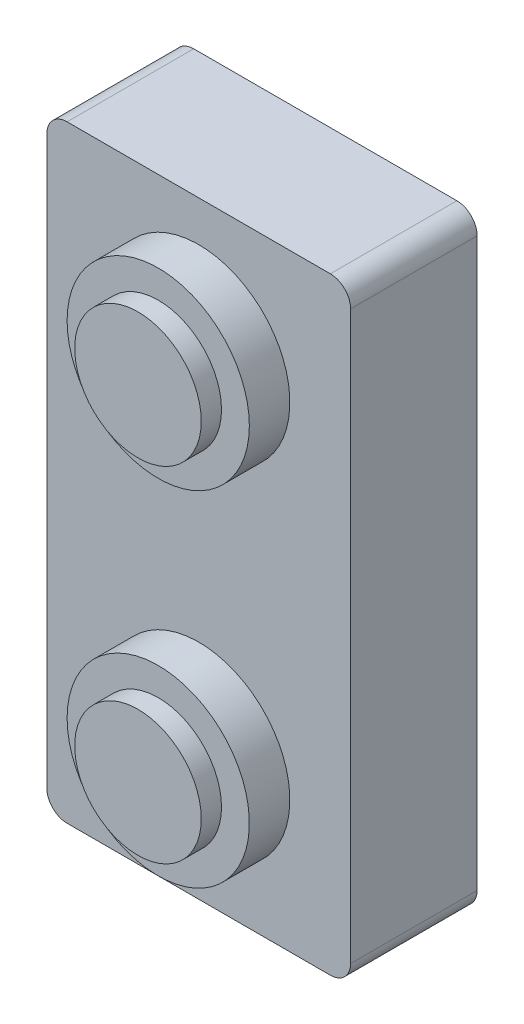
from build123d import *

# Parameters (mm, degrees)
SKETCH_1_W          = 30
SKETCH_1_H          = 60
EXTRUDE_1_DEPTH     = 12.5
SKETCH_2_R          = 9
EXTRUDE_2_DEPTH     = 4
SKETCH_3_R          = 6.25
EXTRUDE_3_DEPTH     = 2
FILLET_1_R          = 2
CUT_EXTRUDE_1_DEPTH = 10


with BuildPart() as part:
    # 草图1 → 凸台-拉伸1 (new body)
    with BuildSketch(Plane.XY):
        Rectangle(SKETCH_1_W, SKETCH_1_H)
    extrude(amount=EXTRUDE_1_DEPTH)

    # 草图2 → 凸台-拉伸2 (add)
    with BuildSketch(Plane.XY.offset(12.5)):
        with Locations(Location((0, 17, 0), (0, 0, 180))):
            Circle(SKETCH_2_R)
        with Locations(Location((0, -17, 0), (0, 0, 180))):
            Circle(SKETCH_2_R)
    extrude(amount=EXTRUDE_2_DEPTH)

    # 草图3 → 凸台-拉伸3 (add)
    with BuildSketch(Plane.XY.offset(16.5)):
        with Locations((0, 17)):
            Circle(SKETCH_3_R)
        with Locations((0, -17)):
            Circle(SKETCH_3_R)
    extrude(amount=EXTRUDE_3_DEPTH)

    # 圆角1
    fillet_1_edges = [part.edges().sort_by_distance(p)[0] for p in [
        (15, -30, 6.25),
        (-15, -30, 6.25),
        (-15, 30, 6.25),
        (15, 30, 6.25),
    ]]
    fillet(fillet_1_edges, radius=FILLET_1_R)

    # 草图4 → 切除-拉伸1 (cut)
    with BuildSketch(Plane.ZY.offset(15)):
        with BuildLine():
            ThreePointArc((10.25, 0), (8.751434736, 3.12134975), (5.37858787, 3.903926344))
            Line((5.37858787, 3.903926344), (6.25, 0))
            Line((6.25, 0), (10.25, 0))
        make_face()
        with BuildLine():
            Line((6.25, 0), (5.37858787, 3.903926344))
            ThreePointArc((5.37858787, 3.903926344), (3.12865025, 2.501434736), (2.25, 0))
            Line((2.25, 0), (6.25, 0))
        make_face()
        with BuildLine():
            Line((10.25, 0), (6.25, 0))
            Line((6.25, 0), (7.12141213, -3.903926344))
            ThreePointArc((7.12141213, -3.903926344), (9.37134975, -2.501434736), (10.25, 0))
        make_face()
        with BuildLine():
            Line((7.12141213, -3.903926344), (6.25, 0))
            Line((6.25, 0), (2.25, 0))
            ThreePointArc((2.25, 0), (3.748565264, -3.12134975), (7.12141213, -3.903926344))
        make_face()
    extrude(amount=-CUT_EXTRUDE_1_DEPTH, mode=Mode.SUBTRACT)


solid = part.part
